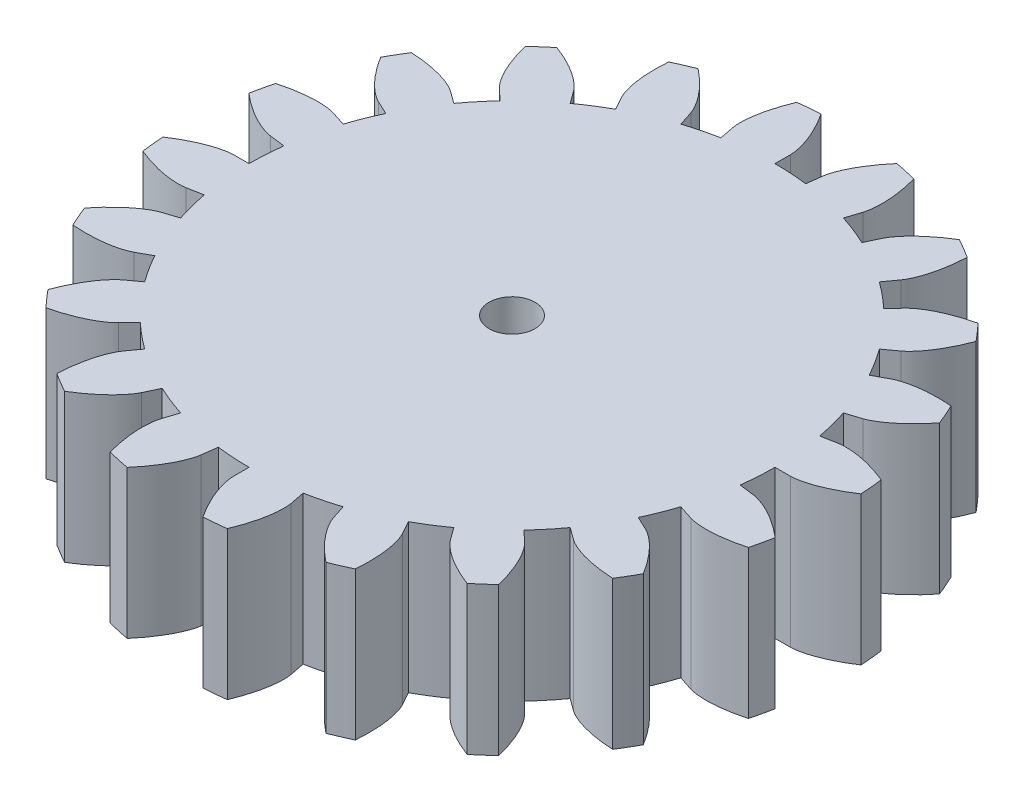
from build123d import *

# Parameters (mm, degrees)
GEAR_BILLET_R             = 22.25
GEAR_BILLET_EXTRUDE_DEPTH = 10
CUT_TOOTH_PROFILE_REACH   = 35.017
DUPLICATE_TEETH_COUNT     = 20
SKETCH1_R                 = 1.55
CUT_EXTRUDE1_DEPTH        = 10


with BuildPart() as part:
    # Gear billet → Gear billet Extrude (new body)
    with BuildSketch(Plane(origin=(0, 0, 0), x_dir=(1, 0, 0), z_dir=(0, 1, 0))):
        with Locations(Location((0, 0, 0), (0, 0, 270))):
            Circle(GEAR_BILLET_R)
    extrude(amount=GEAR_BILLET_EXTRUDE_DEPTH)

    # Tooth profile → Cut tooth profile (cut, up to next)
    with BuildSketch(Plane(origin=(0, 10, 0), x_dir=(1, 0, 0), z_dir=(0, 1, 0)), mode=Mode.PRIVATE) as cut_tooth_profile_sk1:
        with BuildLine():
            Line((0, 18.793852416), (0, 17.75))
            ThreePointArc((0, 17.75), (1.108967305, 17.715323636), (2.213601657, 17.61143003))
            Line((2.213601657, 17.61143003), (2.343780442, 18.647133342))
            add(Edge.make_bspline(
                [(2.343780442, 18.647133342), (2.351011327, 18.704662307), (2.378887105, 18.864728711), (2.46229111, 19.163772783), (2.639630726, 19.635780315), (2.929185047, 20.221897371), (3.32923471, 20.875676419), (3.696503264, 21.374070321), (3.965266569, 21.702604471), (4.107167702, 21.86763987)],
                knots=[0, 0, 0, 0, 0, 0.005604071, 0.015718253, 0.029959921, 0.048733673, 0.068727069, 0.089783319, 0.089783319, 0.089783319, 0.089783319, 0.089783319], degree=4))
            ThreePointArc((4.107167702, 21.86763987), (1.390113946, 22.206532445), (-1.347991704, 22.209129167))
            add(Edge.make_bspline(
                [(0, 18.793852416), (0, 18.851834029), (-0.007696285, 19.014127221), (-0.053155403, 19.321238038), (-0.170246535, 19.811676735), (-0.384445745, 20.429328423), (-0.699839562, 21.12789375), (-1.002086259, 21.668198854), (-1.227779916, 22.027685677), (-1.347991704, 22.209129167)],
                knots=[0, 0, 0, 0, 0, 0.005604071, 0.015718253, 0.029959921, 0.048733673, 0.068727069, 0.089783319, 0.089783319, 0.089783319, 0.089783319, 0.089783319], degree=4))
        make_face()
    cut_tooth_profile_tool1 = extrude(cut_tooth_profile_sk1.sketch, amount=-CUT_TOOTH_PROFILE_REACH, mode=Mode.PRIVATE) & part.part
    cut_tooth_profile = cut_tooth_profile_tool1.solids().sort_by_distance((1.271255, 10, -20.307814))[0]
    add(cut_tooth_profile, mode=Mode.SUBTRACT)

    # Duplicate teeth: Cut tooth profile ×20 about axis
    duplicate_teeth_axis = Axis((0, 10, 0), (0, -1, 0))
    for i in range(1, DUPLICATE_TEETH_COUNT):
        add(cut_tooth_profile.rotate(duplicate_teeth_axis, i * 360 / DUPLICATE_TEETH_COUNT), mode=Mode.SUBTRACT)

    # Sketch1 → Cut-Extrude1 (cut)
    with BuildSketch(Plane.XZ):
        with Locations(Location((0, 0, 0), (0, 0, 270))):
            Circle(SKETCH1_R)
    extrude(amount=-CUT_EXTRUDE1_DEPTH, mode=Mode.SUBTRACT)


solid = part.part
